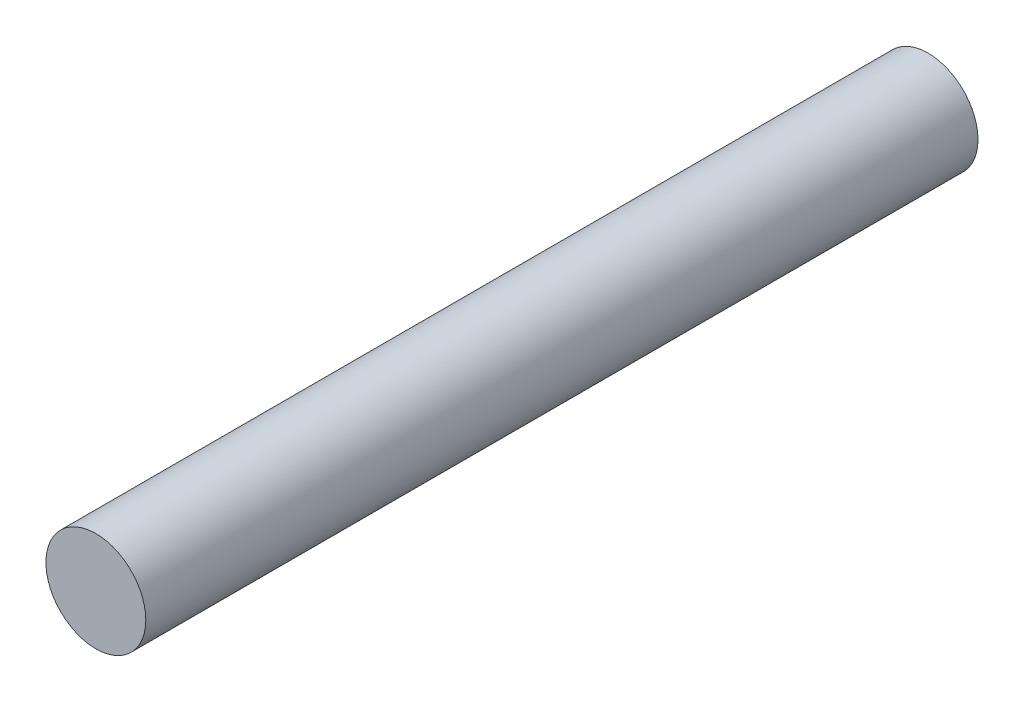
from build123d import *

# Parameters (mm, degrees)
SKETCH_1_R      = 1.5
EXTRUDE_1_DEPTH = 12.5


with BuildPart() as part:
    # 草图1 → 凸台-拉伸1 (new, symmetric)
    with BuildSketch(Plane.XY):
        Circle(SKETCH_1_R)
    extrude(amount=EXTRUDE_1_DEPTH, both=True)


solid = part.part
